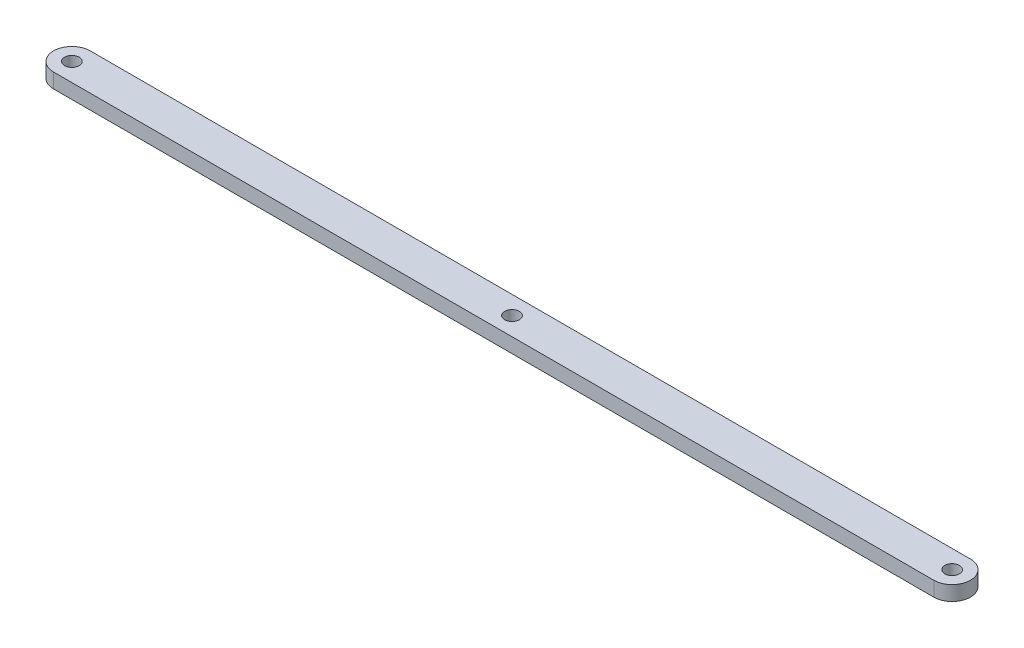
from build123d import *

# Parameters (mm, degrees)
SKETCH1_R           = 1
BOSS_EXTRUDE1_DEPTH = 2


with BuildPart() as part:
    # Sketch1 → Boss-Extrude1 (new body)
    with BuildSketch(Plane(origin=(0, 0, 0), x_dir=(1, 0, 0), z_dir=(0, 1, 0))):
        with BuildLine():
            Line((-60, 2.5), (60, 2.5))
            ThreePointArc((60, 2.5), (62.5, 0), (60, -2.5))
            Line((60, -2.5), (-60, -2.5))
            ThreePointArc((-60, -2.5), (-62.5, 0), (-60, 2.5))
        make_face()
        with Locations(Location((60, 0, 0), (0, 0, 270))):
            Circle(SKETCH1_R, mode=Mode.SUBTRACT)
        with Locations(Location((-60, 0, 0), (0, 0, 270))):
            Circle(SKETCH1_R, mode=Mode.SUBTRACT)
        with Locations(Location((0, 0, 0), (0, 0, 270))):
            Circle(SKETCH1_R, mode=Mode.SUBTRACT)
    extrude(amount=BOSS_EXTRUDE1_DEPTH)


solid = part.part
